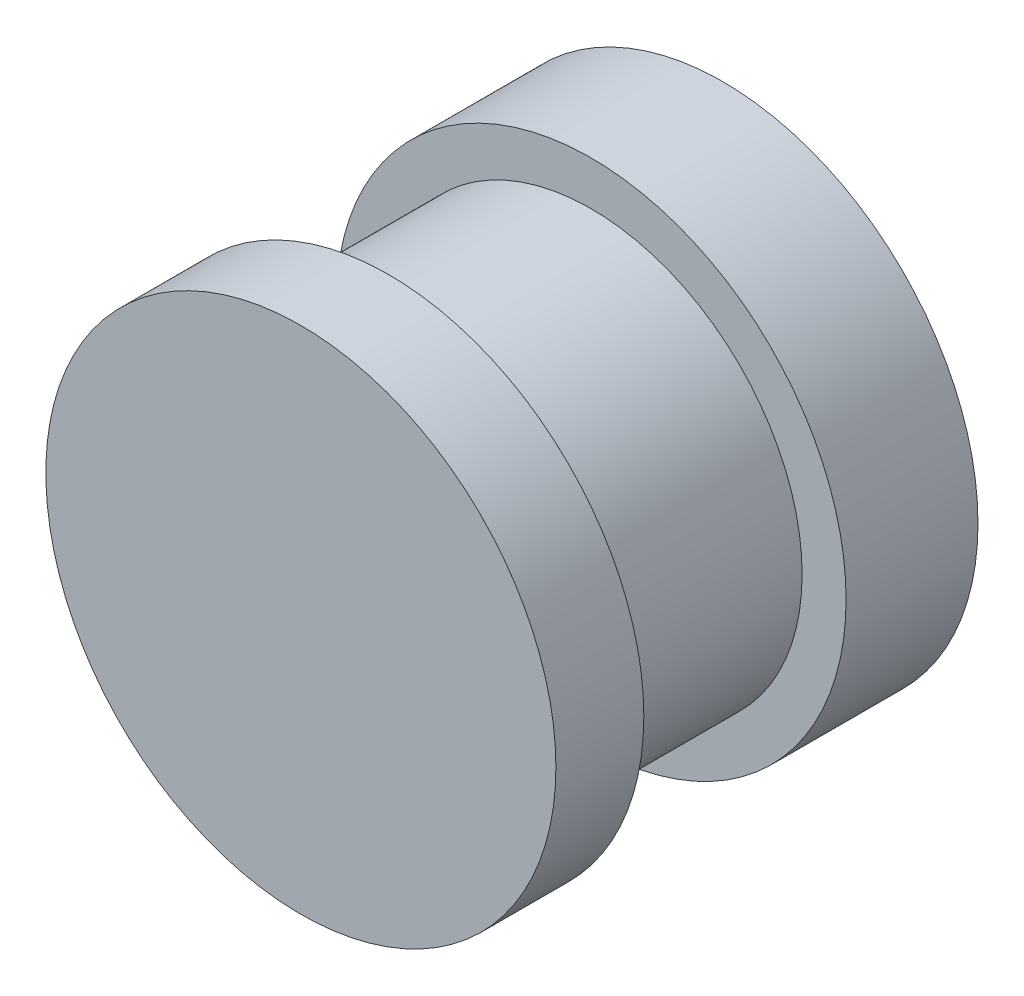
from build123d import *

# Parameters (mm, degrees)
SKETCH_1_R      = 2.9
EXTRUDE_1_DEPTH = 1.5
SKETCH_2_R      = 2.4
EXTRUDE_2_DEPTH = 2.3
SKETCH_3_R      = 2.9
EXTRUDE_3_DEPTH = 1


with BuildPart() as part:
    # Эскиз1 → Бобышка-Вытянуть1 (new body)
    with BuildSketch(Plane.XY):
        Circle(SKETCH_1_R)
    extrude(amount=EXTRUDE_1_DEPTH)

    # Эскиз2 → Бобышка-Вытянуть2 (add)
    with BuildSketch(Plane.XY.offset(1.5)):
        Circle(SKETCH_2_R)
    extrude(amount=EXTRUDE_2_DEPTH)

    # Эскиз3 → Бобышка-Вытянуть3 (add)
    with BuildSketch(Plane.XY.offset(3.8)):
        Circle(SKETCH_3_R)
    extrude(amount=EXTRUDE_3_DEPTH)


solid = part.part
